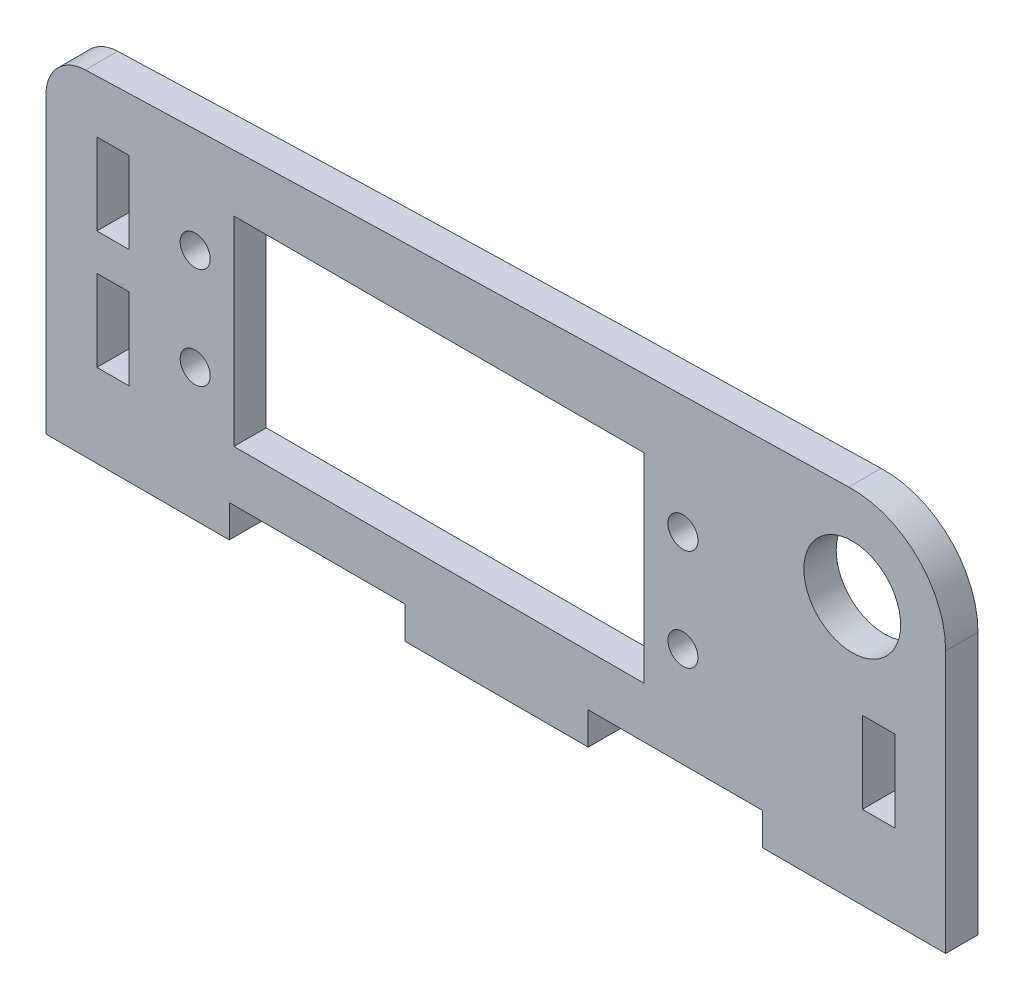
from build123d import *

# Parameters (mm, degrees)
SKETCH1_W            = 6.266
SKETCH1_H            = 19.6
SKETCH1_R            = 1.475
SKETCH1_W_2          = 52.832
SKETCH1_H_2          = 5
BOSS_EXTRUDE2_DEPTH  = 3.175
SKETCH3_W            = 30
SKETCH3_H            = 29.6
BOSS_EXTRUDE3_DEPTH  = 3.175
SKETCH4_R            = 4.75
CUT_EXTRUDE1_DEPTH   = 10
BOSS_EXTRUDE14_DEPTH = 3.175
CUT_EXTRUDE8_DEPTH   = 10
BOSS_EXTRUDE15_DEPTH = 3.175
BOSS_EXTRUDE16_DEPTH = 3.175
BOSS_EXTRUDE17_DEPTH = 3.175
FILLET5_R            = 4
SKETCH27_W           = 3.175
SKETCH27_H           = 8
CUT_EXTRUDE9_DEPTH   = 10
SKETCH28_W           = 18
SKETCH28_H           = 3.175
BOSS_EXTRUDE18_DEPTH = 3.175


with BuildPart() as part:
    # Sketch1 → Boss-Extrude2 (new body)
    # profile 1 of 4: a face of its own
    with BuildSketch(Plane.XY):
        with Locations((-23.283, 0)):
            Rectangle(SKETCH1_W, SKETCH1_H)
        with Locations((-23.95, -4.974)):
            Circle(SKETCH1_R, mode=Mode.SUBTRACT)
        with Locations((-23.95, 4.974)):
            Circle(SKETCH1_R, mode=Mode.SUBTRACT)
    # profile 2 of 4: a face of its own
    with BuildSketch(Plane.XY):
        with Locations((23.283, 0)):
            Rectangle(SKETCH1_W, SKETCH1_H)
        with Locations((23.95, -4.974)):
            Circle(SKETCH1_R, mode=Mode.SUBTRACT)
        with Locations((23.95, 4.974)):
            Circle(SKETCH1_R, mode=Mode.SUBTRACT)
    # profile 3 of 4: a face of its own
    with BuildSketch(Plane.XY):
        with Locations((0, 12.3)):
            Rectangle(SKETCH1_W_2, SKETCH1_H_2)
    # profile 4 of 4: a face of its own
    with BuildSketch(Plane.XY):
        with Locations((0, -12.3)):
            Rectangle(SKETCH1_W_2, SKETCH1_H_2)
    extrude(amount=BOSS_EXTRUDE2_DEPTH)

    # Sketch3 → Boss-Extrude3 (add)
    with BuildSketch(Plane.XY.offset(3.175)):
        with Locations((41.416, 0)):
            Rectangle(SKETCH3_W, SKETCH3_H)
    extrude(amount=-BOSS_EXTRUDE3_DEPTH)

    # Sketch4 → Cut-Extrude1 (cut)
    with BuildSketch(Plane(origin=(0, 0, 0), x_dir=(-1, 0, 0), z_dir=(0, 0, -1))):
        with Locations((-40.576, 7.77)):
            Circle(SKETCH4_R)
    extrude(amount=-CUT_EXTRUDE1_DEPTH, mode=Mode.SUBTRACT)

    # Sketch22 → Boss-Extrude14 (add)
    with BuildSketch(Plane(origin=(0, 0, 0), x_dir=(-1, 0, 0), z_dir=(0, 0, -1))):
        with BuildLine():
            ThreePointArc((-34.680262133, 14.8), (-40.576, 16.945), (-46.471737867, 14.8))
            Line((-46.471737867, 14.8), (-34.680262133, 14.8))
        make_face()
    extrude(amount=-BOSS_EXTRUDE14_DEPTH)

    # Sketch23 → Cut-Extrude8 (cut)
    with BuildSketch(Plane(origin=(0, 0, 0), x_dir=(-1, 0, 0), z_dir=(0, 0, -1))):
        with BuildLine():
            Line((-49.751, -14.8), (-49.751, 7.77))
            ThreePointArc((-49.751, 7.77), (-48.890866804, 11.648609936), (-46.471737867, 14.8))
            Line((-46.471737867, 14.8), (-56.416, 14.8))
            Line((-56.416, 14.8), (-56.416, -14.8))
            Line((-56.416, -14.8), (-49.751, -14.8))
        make_face()
    extrude(amount=-CUT_EXTRUDE8_DEPTH, mode=Mode.SUBTRACT)

    # Sketch24 → Boss-Extrude15 (add)
    with BuildSketch(Plane(origin=(0, 0, 0), x_dir=(-1, 0, 0), z_dir=(0, 0, -1))):
        Polygon((30.425, 14.8), (26.416, 14.8), (26.416, -14.8), (27.751006616, -14.8), (30.425, -14.8), align=None)
    extrude(amount=-BOSS_EXTRUDE15_DEPTH)

    # Sketch25 → Boss-Extrude16 (add)
    with BuildSketch(Plane(origin=(0, 0, 0), x_dir=(-1, 0, 0), z_dir=(0, 0, -1))):
        Polygon((30.425, 14.8), (30.425, 9.8), (33.6, 9.8), (33.6, 1.8), (30.425, 1.8), (30.425, -1.8), (33.6, -1.8), (33.6, -9.8), (30.425, -9.8), (30.425, -14.8), (31.879074074, -14.8), (38.6, -14.8), (38.6, 14.8), align=None)
    extrude(amount=-BOSS_EXTRUDE16_DEPTH)

    # Sketch26 → Boss-Extrude17 (add)
    with BuildSketch(Plane(origin=(0, 0, 0), x_dir=(-1, 0, 0), z_dir=(0, 0, -1))):
        with BuildLine():
            ThreePointArc((-40.224226578, 16.938253948), (-37.274351652, 16.330358823), (-34.680262133, 14.8))
            Line((-34.680262133, 14.8), (38.6, 14.8))
            ThreePointArc((38.6, 14.8), (-0.807884867, 16.02500278), (-40.224226578, 16.938253948))
        make_face()
    extrude(amount=-BOSS_EXTRUDE17_DEPTH)

    # Fillet5
    fillet5_edges = [part.edges().sort_by_distance(p)[0] for p in [
        (-38.6, 14.8, 1.5875),
    ]]
    fillet(fillet5_edges, radius=FILLET5_R)

    # Sketch27 → Cut-Extrude9 (cut)
    with BuildSketch(Plane(origin=(0, 0, 0), x_dir=(-1, 0, 0), z_dir=(0, 0, -1))):
        with Locations((-43.1635, -5.8)):
            Rectangle(SKETCH27_W, SKETCH27_H)
    extrude(amount=-CUT_EXTRUDE9_DEPTH, mode=Mode.SUBTRACT)

    # Sketch28 → Boss-Extrude18 (add)
    with BuildSketch(Plane(origin=(0, 0, 0), x_dir=(-1, 0, 0), z_dir=(0, 0, -1))):
        with Locations((-40.751, -16.3875)):
            Rectangle(SKETCH28_W, SKETCH28_H)
        with Locations((-5.65, -16.3875)):
            Rectangle(SKETCH28_W, SKETCH28_H)
        with Locations((29.6, -16.3875)):
            Rectangle(SKETCH28_W, SKETCH28_H)
    extrude(amount=-BOSS_EXTRUDE18_DEPTH)


solid = part.part
